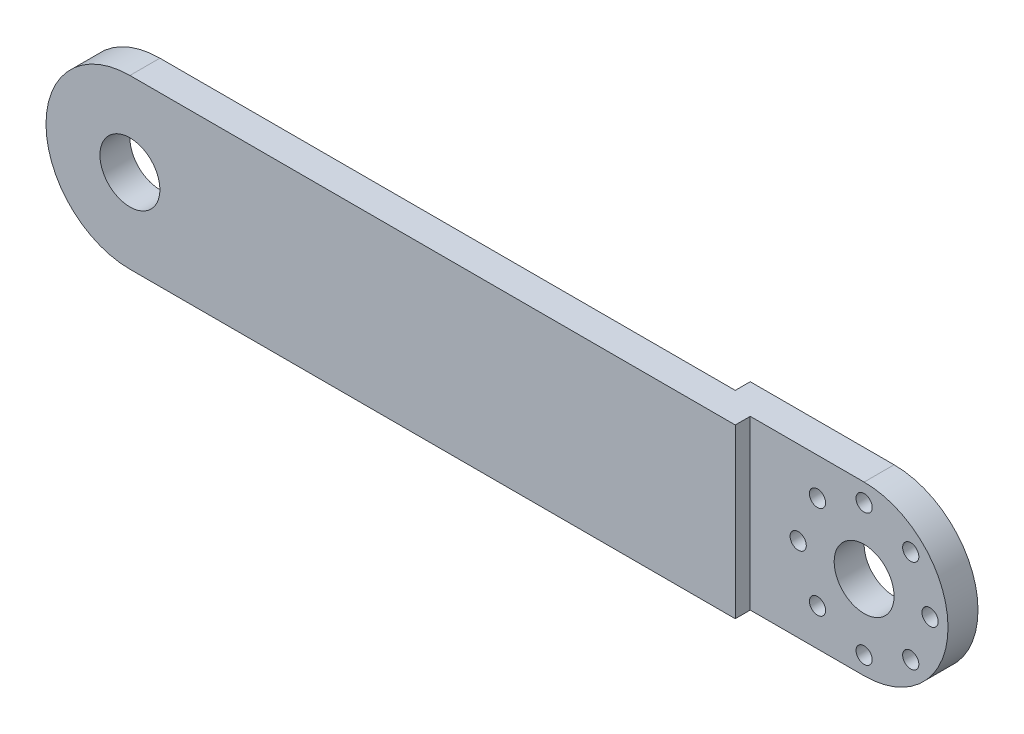
from build123d import *

# Parameters (mm, degrees)
RESSALTO_EXTRUS_O1_DEPTH = 5
ESBO_O2_R                = 1.35
ESBO_O2_R_2              = 1.373066436
ESBO_O2_R_3              = 1.330065432
ESBO_O2_R_4              = 5
CORTE_EXTRUS_O1_DEPTH    = 137.810087347
ESBO_O3_R                = 5
CORTE_EXTRUS_O2_DEPTH    = 137.810087347
ESBO_O5_W                = 31.24115408
ESBO_O5_H                = 28
CORTE_EXTRUS_O3_DEPTH    = 137.810087347
ESBO_O6_W                = 5
ESBO_O6_H                = 28
RESSALTO_EXTRUS_O2_DEPTH = 2.5
RESSALTO_EXTRUS_O4_DEPTH = 5
ESBO_O8_R                = 5
ESBO_O8_R_2              = 1.35
CORTE_EXTRUS_O4_DEPTH    = 135.937948702
ESBO_O10_W               = 5
ESBO_O10_H               = 2.5
CORTE_EXTRUS_O5_DEPTH    = 137.985400682
ESBO_O11_W               = 5
ESBO_O11_H               = 2.5
RESSALTO_EXTRUS_O5_DEPTH = 28


with BuildPart() as part:
    # Esboço1 → Ressalto-extrusão1 (new body)
    with BuildSketch(Plane.XY):
        with BuildLine():
            Line((0, -14), (122, -14))
            ThreePointArc((122, -14), (136, 0), (122, 14))
            Line((122, 14), (0, 14))
            ThreePointArc((0, 14), (-14, 0), (0, -14))
        make_face()
    extrude(amount=RESSALTO_EXTRUS_O1_DEPTH)

    # Esboço2 → Corte-extrusão1 (cut, through all)
    with BuildSketch(Plane(origin=(0, 0, 0), x_dir=(-1, 0, 0), z_dir=(0, 0, -1))):
        with Locations((-125.327123404, 10.484762747)):
            Circle(ESBO_O2_R)
        with Locations((-116.938784683, 9.766478358)):
            Circle(ESBO_O2_R)
        with Locations((-111.515237253, 3.327123404)):
            Circle(ESBO_O2_R)
        with Locations((-112.233521642, -5.061215317)):
            Circle(ESBO_O2_R)
        with Locations((-118.672876596, -10.484762747)):
            Circle(ESBO_O2_R_2)
        with Locations((-127.061215317, -9.766478358)):
            Circle(ESBO_O2_R_3)
        with Locations((-132.484762747, -3.327123404)):
            Circle(ESBO_O2_R)
        with Locations((-131.766478358, 5.061215317)):
            Circle(ESBO_O2_R)
        with Locations((-122, 0)):
            Circle(ESBO_O2_R_4)
    extrude(amount=-CORTE_EXTRUS_O1_DEPTH, mode=Mode.SUBTRACT)

    # Esboço3 → Corte-extrusão2 (cut, through all)
    with BuildSketch(Plane(origin=(0, 0, 0), x_dir=(-1, 0, 0), z_dir=(0, 0, -1))):
        Circle(ESBO_O3_R)
    extrude(amount=-CORTE_EXTRUS_O2_DEPTH, mode=Mode.SUBTRACT)

    # Esboço5 → Corte-extrusão3 (cut, through all)
    with BuildSketch(Plane(origin=(0, 0, 0), x_dir=(-1, 0, 0), z_dir=(0, 0, -1))):
        with Locations((-121.62057704, 0)):
            Rectangle(ESBO_O5_W, ESBO_O5_H)
    extrude(amount=-CORTE_EXTRUS_O3_DEPTH, mode=Mode.SUBTRACT)

    # Esboço6 → Ressalto-extrusão2 (add)
    with BuildSketch(Plane(origin=(0, 0, 0), x_dir=(-1, 0, 0), z_dir=(0, 0, -1))):
        with Locations((-103.5, 0)):
            Rectangle(ESBO_O6_W, ESBO_O6_H)
    extrude(amount=RESSALTO_EXTRUS_O2_DEPTH)

    # Esboço7 → Ressalto-extrusão4 (add)
    with BuildSketch(Plane(origin=(0, 0, -2.5), x_dir=(-1, 0, 0), z_dir=(0, 0, -1))):
        with BuildLine():
            Line((-106, 14), (-120, 14))
            ThreePointArc((-120, 14), (-134, 0), (-120, -14))
            Line((-120, -14), (-106, -14))
            Line((-106, -14), (-106, 14))
        make_face()
    extrude(amount=-RESSALTO_EXTRUS_O4_DEPTH)

    # Esboço8 → Corte-extrusão4 (cut, through all)
    with BuildSketch(Plane(origin=(0, 0, -2.5), x_dir=(-1, 0, 0), z_dir=(0, 0, -1))):
        with Locations((-120, 0)):
            Circle(ESBO_O8_R)
        with Locations((-120, 11)):
            Circle(ESBO_O8_R_2)
        with Locations((-109, 0)):
            Circle(ESBO_O8_R_2)
        with Locations((-120, -11)):
            Circle(ESBO_O8_R_2)
        with Locations((-131, 0)):
            Circle(ESBO_O8_R_2)
        with Locations((-112.221825407, 7.778174593)):
            Circle(ESBO_O8_R_2)
        with Locations((-112.221825407, -7.778174593)):
            Circle(ESBO_O8_R_2)
        with Locations((-127.778174593, -7.778174593)):
            Circle(ESBO_O8_R_2)
        with Locations((-127.778174593, 7.778174593)):
            Circle(ESBO_O8_R_2)
    extrude(amount=-CORTE_EXTRUS_O4_DEPTH, mode=Mode.SUBTRACT)

    # Esboço10 → Corte-extrusão5 (cut, through all)
    with BuildSketch(Plane.XZ.offset(14)):
        with Locations((103.5, 3.75)):
            Rectangle(ESBO_O10_W, ESBO_O10_H)
    extrude(amount=-CORTE_EXTRUS_O5_DEPTH, mode=Mode.SUBTRACT)

    # Esboço11 → Ressalto-extrusão5 (add, through all)
    with BuildSketch(Plane.XZ.offset(14)):
        with Locations((98.5, -1.25)):
            Rectangle(ESBO_O11_W, ESBO_O11_H)
    extrude(amount=-RESSALTO_EXTRUS_O5_DEPTH)


solid = part.part
